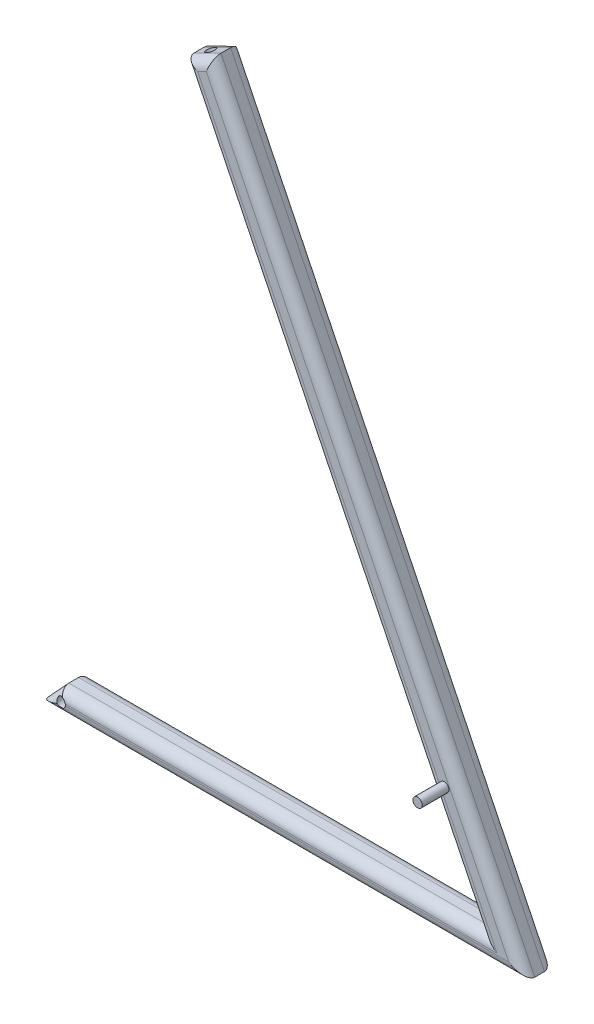
from build123d import *

# Parameters (mm, degrees)
BOSS_EXTRUDE1_DEPTH = 44.5
FILLET2_R           = 15
SKETCH2_R           = 7
CUT_EXTRUDE1_DEPTH  = 14
SKETCH3_R           = 7
CUT_EXTRUDE2_DEPTH  = 14
SKETCH4_R           = 7
CUT_EXTRUDE3_DEPTH  = 14
SKETCH5_R           = 7
CUT_EXTRUDE4_DEPTH  = 952.271625519
SKETCH6_W           = 14.5
SKETCH6_H           = 44.5
CUT_EXTRUDE5_DEPTH  = 936.632574619
BOSS_EXTRUDE3_DEPTH = 40


with BuildPart() as part:
    # Sketch1 → Boss-Extrude1 (new body)
    with BuildSketch(Plane.XY):
        Polygon((-253.518736915, -141.579738071), (475.109189289, -141.579738071), (4.687860899, 822.926918688), (-35.308474161, 803.419402656), (409.63823983, -108.856554338), (-223.36176017, -108.856554338), align=None)
    extrude(amount=BOSS_EXTRUDE1_DEPTH)

    # Fillet2
    fillet2_edges = [part.edges().sort_by_distance(p)[0] for p in [
        (239.898525094, 340.673590309, 44.5),
        (-15.310306631, 813.173160672, 44.5),
        (187.164882834, 347.281424159, 44.5),
        (93.13823983, -108.856554338, 44.5),
        (-238.440248543, -125.218146204, 44.5),
        (93.13823983, -108.856554338, 0),
        (187.164882834, 347.281424159, 0),
        (-15.310306631, 813.173160672, 0),
        (239.898525094, 340.673590309, 0),
        (110.795226187, -141.579738071, 0),
        (-238.440248543, -125.218146204, 0),
        (110.795226187, -141.579738071, 44.5),
    ]]
    fillet(fillet2_edges, radius=FILLET2_R)

    # Sketch2 → Cut-Extrude1 (cut)
    with BuildSketch(Plane(origin=(-323.336767908, 662.938617367, 0), x_dir=(0.8987940462991654, 0.43837114678908073, 0), z_dir=(-0.43837114678908073, 0.8987940462991654, 0))):
        with Locations(Location((339.470196695, -21.913602874, 0), (0, 0, 180))):
            Circle(SKETCH2_R)
    extrude(amount=-CUT_EXTRUDE1_DEPTH, mode=Mode.SUBTRACT)

    # Sketch3 → Cut-Extrude2 (cut)
    with BuildSketch(Plane(origin=(-66.534083276, 61.316368798, 0), x_dir=(0, 0, 1), z_dir=(-0.735352443447444, 0.6776848706558778, 0))):
        with Locations(Location((22.366337019, -255.510068241, 0), (0, 0, 270))):
            Circle(SKETCH3_R)
    extrude(amount=-CUT_EXTRUDE2_DEPTH, mode=Mode.SUBTRACT)

    # Sketch4 → Cut-Extrude3 (cut)
    with BuildSketch(Plane(origin=(0, -141.579738071, 0), x_dir=(-1, 0, 0), z_dir=(0, -1, 0))):
        with Locations(Location((233.419507196, -21.201481555, 0), (0, 0, 117.634316404))):
            Circle(SKETCH4_R)
    extrude(amount=-CUT_EXTRUDE3_DEPTH, mode=Mode.SUBTRACT)

    # Sketch5 → Cut-Extrude4 (cut, through all)
    with BuildSketch(Plane.XY.offset(44.5)):
        with Locations(Location((-220.649115428, -125.427110978, 0), (0, 0, 350.522457382))):
            Circle(SKETCH5_R)
    extrude(amount=-CUT_EXTRUDE4_DEPTH, mode=Mode.SUBTRACT)

    # Sketch6 → Cut-Extrude5 (cut, through all)
    with BuildSketch(Plane(origin=(-66.534083276, 61.316368798, 0), x_dir=(0, 0, 1), z_dir=(-0.735352443447444, 0.6776848706558778, 0))):
        with Locations((22.25, -253.666818768)):
            Rectangle(SKETCH6_W, SKETCH6_H)
    extrude(amount=-CUT_EXTRUDE5_DEPTH, mode=Mode.SUBTRACT)

    # Sketch8 → Boss-Extrude3 (add)
    with BuildSketch(Plane.XY.offset(44.5)):
        with BuildLine():
            ThreePointArc((350.492241226, 46.628294304), (357.703100488, 46.229913436), (361.428471817, 52.416738718))
            ThreePointArc((361.428471817, 52.416738718), (354.659562876, 59.412923172), (347.443729839, 52.878668912))
            Line((347.443729839, 52.878668912), (350.492241226, 46.628294304))
        make_face()
        with BuildLine():
            Line((350.492241226, 46.628294304), (347.443729839, 52.878668912))
            ThreePointArc((347.443729839, 52.878668912), (348.136913493, 49.34814069), (350.492241226, 46.628294304))
        make_face()
    extrude(amount=BOSS_EXTRUDE3_DEPTH)


solid = part.part
